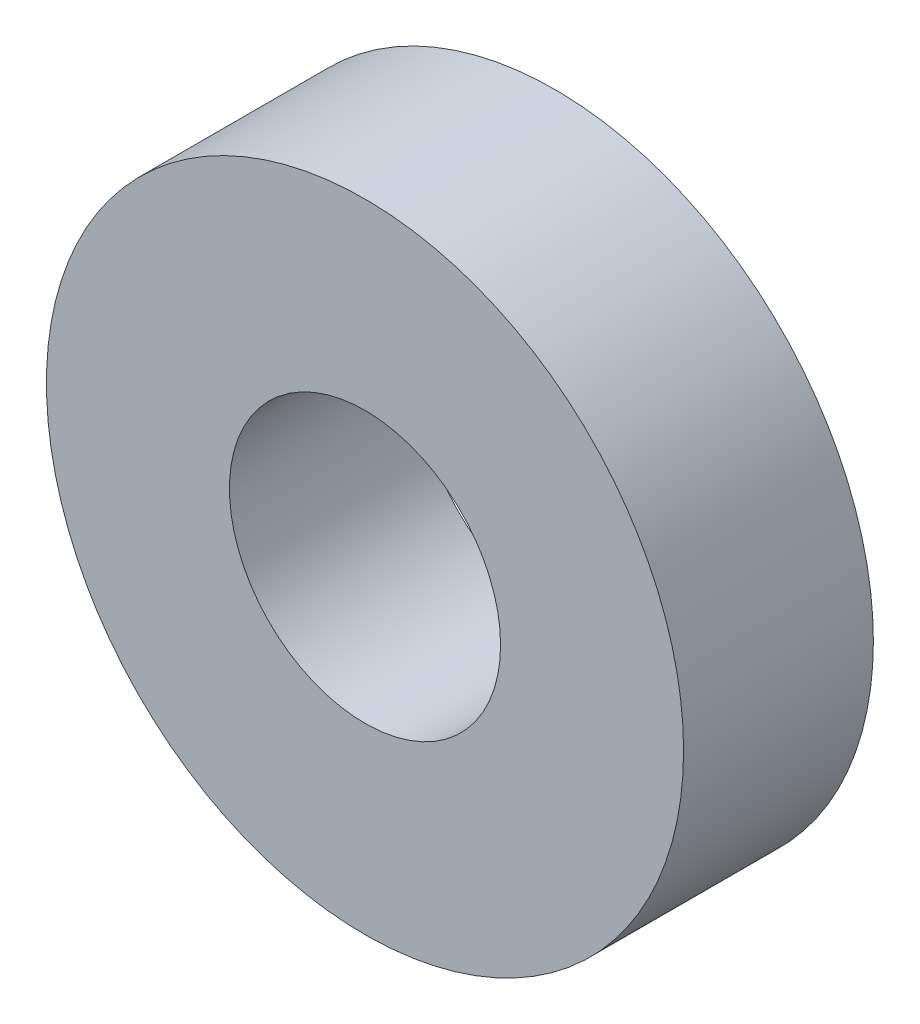
from build123d import *

# Parameters (mm, degrees)
PURCHASED_BEARING_ENVELOPE_START = -40
SKETCH_1_R                       = 23.5
SKETCH_1_R_2                     = 10
PURCHASED_BEARING_ENVELOPE_DEPTH = 14


with BuildPart() as part:
    # Эскиз1 → Purchased_bearing_envelope (new body)
    with BuildSketch(Plane.XY.offset(PURCHASED_BEARING_ENVELOPE_START)):
        Circle(SKETCH_1_R)
        Circle(SKETCH_1_R_2, mode=Mode.SUBTRACT)
    extrude(amount=PURCHASED_BEARING_ENVELOPE_DEPTH)


solid = part.part
